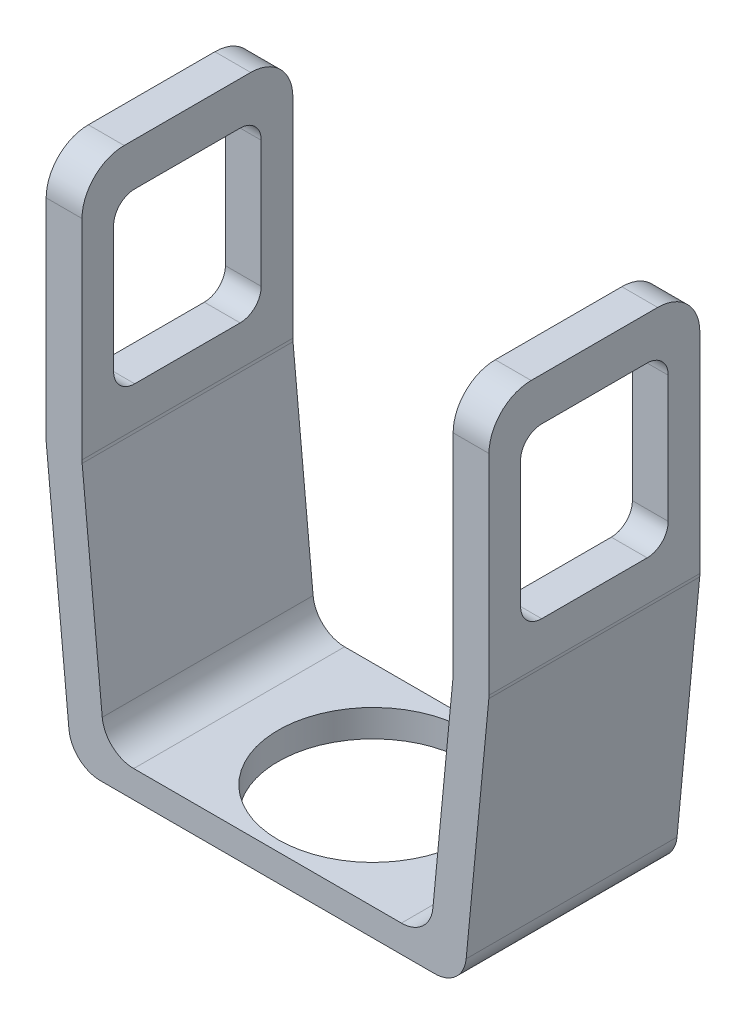
from build123d import *

# Parameters (mm, degrees)
SALIENTE_EXTRUIR1_DEPTH = 5
CROQUIS2_R              = 4.5
CORTAR_EXTRUIR1_DEPTH   = 28.257564023
CROQUIS3_W              = 7
CROQUIS3_H              = 8
CORTAR_EXTRUIR2_DEPTH   = 33.767740179
REDONDEO1_R             = 2
REDONDEO2_R             = 1


with BuildPart() as part:
    # Croquis1 → Saliente-Extruir1 (new, symmetric)
    with BuildSketch(Plane.XY):
        with BuildLine():
            Line((-8.8, 24.652074892), (-10.5, 24.652074892))
            Line((-10.5, 24.652074892), (-10.5, 12.723760553))
            ThreePointArc((-10.5, 12.723760553), (-10.498289984, 12.652156614), (-10.493163835, 12.580715934))
            Line((-10.493163835, 12.580715934), (-9.417931151, 1.356955381))
            ThreePointArc((-9.417931151, 1.356955381), (-8.933586693, 0.389917361), (-7.924767316, 0))
            Line((-7.924767316, 0), (7.924767316, 0))
            ThreePointArc((7.924767316, 0), (8.933586693, 0.389917361), (9.417931151, 1.356955381))
            Line((9.417931151, 1.356955381), (10.493163835, 12.580715934))
            ThreePointArc((10.493163835, 12.580715934), (10.498289984, 12.652156614), (10.5, 12.723760553))
            Line((10.5, 12.723760553), (10.5, 24.652074892))
            Line((10.5, 24.652074892), (8.8, 24.652074892))
            Line((8.8, 24.652074892), (8.8, 12.739594081))
            ThreePointArc((8.8, 12.739594081), (8.798289984, 12.667990142), (8.793163835, 12.596549461))
            Line((8.793163835, 12.596549461), (7.839995893, 2.646955381))
            ThreePointArc((7.839995893, 2.646955381), (7.355651435, 1.679917361), (6.346832058, 1.29))
            Line((6.346832058, 1.29), (-6.346832058, 1.29))
            ThreePointArc((-6.346832058, 1.29), (-7.355651435, 1.679917361), (-7.839995893, 2.646955381))
            Line((-7.839995893, 2.646955381), (-8.793163835, 12.596549461))
            ThreePointArc((-8.793163835, 12.596549461), (-8.798289984, 12.667990142), (-8.8, 12.739594081))
            Line((-8.8, 12.739594081), (-8.8, 24.652074892))
        make_face()
    extrude(amount=SALIENTE_EXTRUIR1_DEPTH, both=True)

    # Croquis2 → Cortar-Extruir1 (cut, through all)
    with BuildSketch(Plane.XZ):
        with Locations(Location((0, 0, 0), (0, 0, 270))):
            Circle(CROQUIS2_R)
    extrude(amount=-CORTAR_EXTRUIR1_DEPTH, mode=Mode.SUBTRACT)

    # Croquis3 → Cortar-Extruir2 (cut, through all)
    with BuildSketch(Plane(origin=(10.5, 0, 0), x_dir=(0, 0, -1), z_dir=(1, 0, 0))):
        with Locations((0, 18.616395413)):
            Rectangle(CROQUIS3_W, CROQUIS3_H)
    extrude(amount=-CORTAR_EXTRUIR2_DEPTH, mode=Mode.SUBTRACT)

    # Redondeo1
    redondeo1_edges = [part.edges().sort_by_distance(p)[0] for p in [
        (9.65, 24.652074892, -5),
        (-9.65, 24.652074892, -5),
        (9.65, 24.652074892, 5),
        (-9.65, 24.652074892, 5),
    ]]
    fillet(redondeo1_edges, radius=REDONDEO1_R)

    # Redondeo2
    redondeo2_edges = [part.edges().sort_by_distance(p)[0] for p in [
        (-9.65, 22.616395413, -3.5),
        (9.65, 22.616395413, -3.5),
        (-9.65, 14.616395413, -3.5),
        (9.65, 14.616395413, -3.5),
        (-9.65, 14.616395413, 3.5),
        (9.65, 14.616395413, 3.5),
        (-9.65, 22.616395413, 3.5),
        (9.65, 22.616395413, 3.5),
    ]]
    fillet(redondeo2_edges, radius=REDONDEO2_R)


solid = part.part
